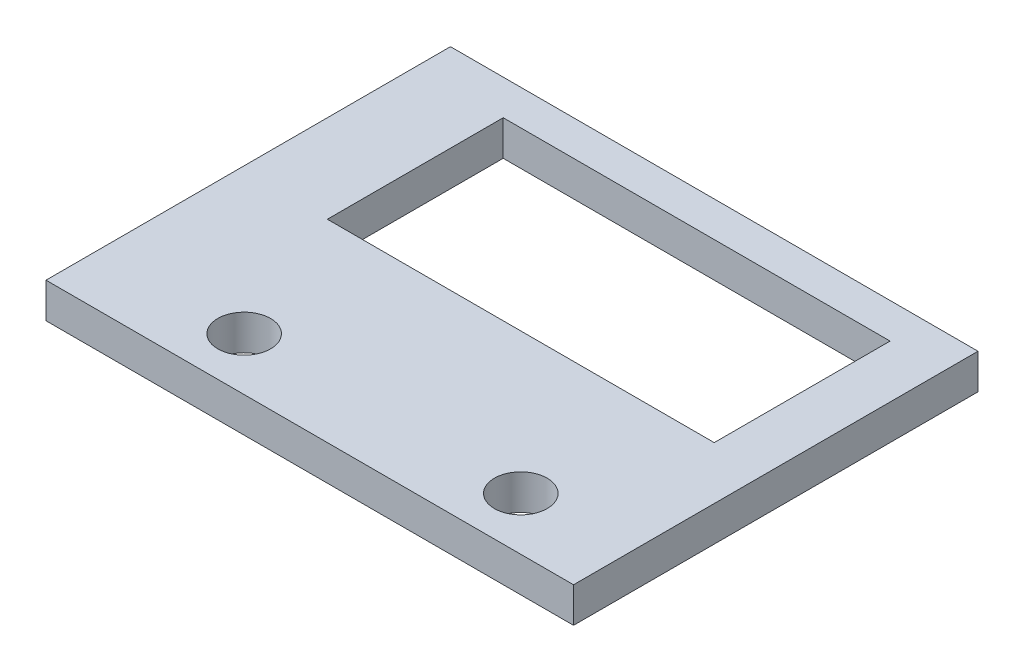
from build123d import *

# Parameters (mm, degrees)
SKETCH1_W           = 30
SKETCH1_H           = 23
BOSS_EXTRUDE1_DEPTH = 2
SKETCH3_R           = 1.5
SKETCH3_W           = 22
SKETCH3_H           = 10
CUT_EXTRUDE2_DEPTH  = 3


with BuildPart() as part:
    # Sketch1 → Boss-Extrude1 (new body)
    with BuildSketch(Plane(origin=(0, 0, 0), x_dir=(1, 0, 0), z_dir=(0, 1, 0))):
        Rectangle(SKETCH1_W, SKETCH1_H)
    extrude(amount=BOSS_EXTRUDE1_DEPTH)

    # Sketch3 → Cut-Extrude2 (cut)
    with BuildSketch(Plane(origin=(0, 2, 0), x_dir=(1, 0, 0), z_dir=(0, 1, 0))):
        with Locations(Location((-6.73, -8.5, 0), (0, 0, 270))):
            Circle(SKETCH3_R)
        with Locations(Location((9, -8.5, 0), (0, 0, 270))):
            Circle(SKETCH3_R)
        with Locations((1, 4.5)):
            Rectangle(SKETCH3_W, SKETCH3_H)
    extrude(amount=-CUT_EXTRUDE2_DEPTH, mode=Mode.SUBTRACT)


solid = part.part
